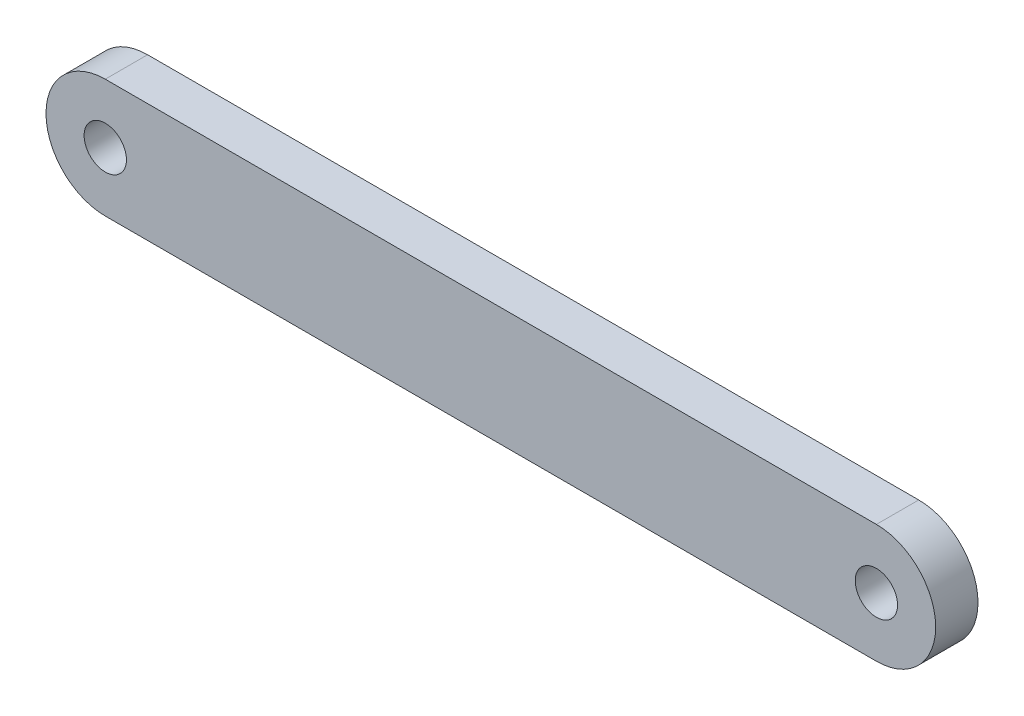
from build123d import *

# Parameters (mm, degrees)
SKETCH1_R           = 3.175
BOSS_EXTRUDE1_DEPTH = 6.35


with BuildPart() as part:
    # Sketch1 → Boss-Extrude1 (new body)
    with BuildSketch(Plane.XY):
        with BuildLine():
            Line((-49.444208902, -8.773302225), (66.227391098, -8.773302225))
            ThreePointArc((66.227391098, -8.773302225), (75.117391098, 0.116697775), (66.227391098, 9.006697775))
            Line((66.227391098, 9.006697775), (-49.444208902, 9.006697775))
            ThreePointArc((-49.444208902, 9.006697775), (-58.334208902, 0.116697775), (-49.444208902, -8.773302225))
        make_face()
        with Locations((-49.444208902, 0.116697775)):
            Circle(SKETCH1_R, mode=Mode.SUBTRACT)
        with Locations((66.227391098, 0.116697775)):
            Circle(SKETCH1_R, mode=Mode.SUBTRACT)
    extrude(amount=BOSS_EXTRUDE1_DEPTH)


solid = part.part
